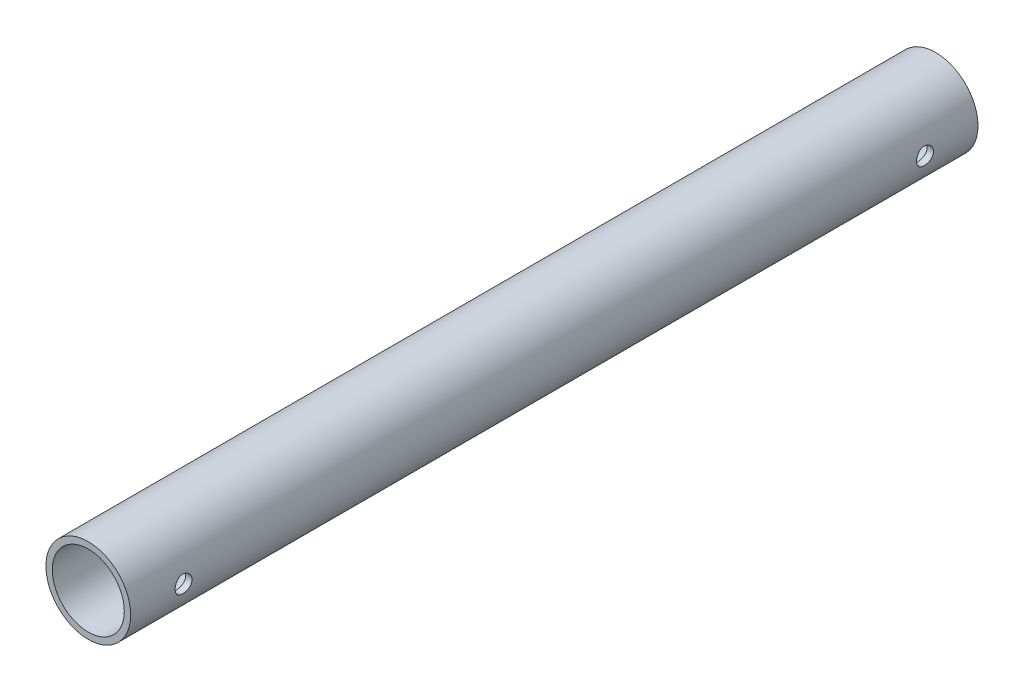
from build123d import *

# Parameters (mm, degrees)
SKETCH1_R           = 10
SKETCH1_R_2         = 8.5
BOSS_EXTRUDE1_DEPTH = 100
SKETCH2_R           = 2
CUT_EXTRUDE1_DEPTH  = 101.995049384


with BuildPart() as part:
    # Sketch1 → Boss-Extrude1 (new body)
    with BuildSketch(Plane.XY):
        Circle(SKETCH1_R)
        Circle(SKETCH1_R_2, mode=Mode.SUBTRACT)
    boss_extrude1 = extrude(amount=BOSS_EXTRUDE1_DEPTH)

    # Sketch2 → Cut-Extrude1 (cut, symmetric)
    with BuildSketch(Plane(origin=(0, 0, 0), x_dir=(0, 0, -1), z_dir=(1, 0, 0))):
        with Locations((-12.5, 0)):
            Circle(SKETCH2_R)
    cut_extrude1 = extrude(amount=CUT_EXTRUDE1_DEPTH, both=True, mode=Mode.SUBTRACT)

    # Mirror1: Boss-Extrude1, Cut-Extrude1 across plane
    add(boss_extrude1.mirror(Plane.XY.offset(100)))
    add(cut_extrude1.mirror(Plane.XY.offset(100)), mode=Mode.SUBTRACT)


solid = part.part
